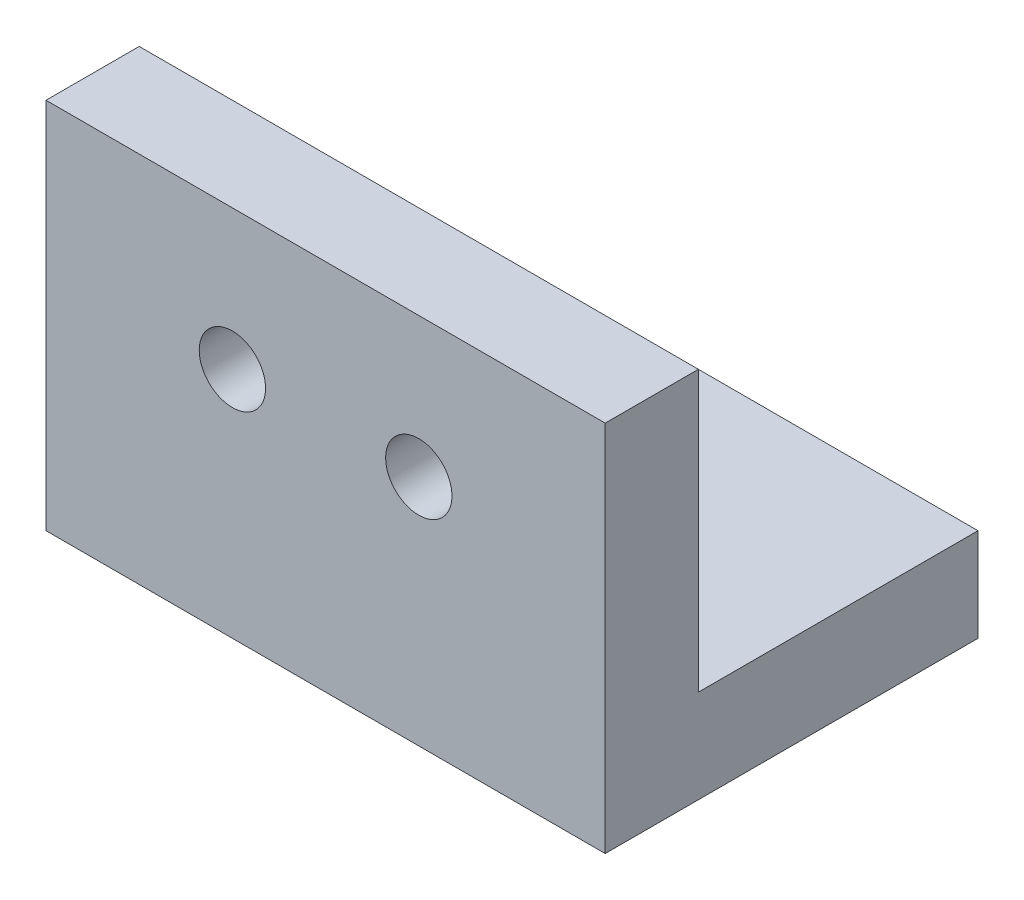
from build123d import *

# Parameters (mm, degrees)
BOSS_EXTRUDE1_DEPTH             = 19.05
F_43_0_089_DIAMETER_HOLE1_D     = 2.2606
F_43_0_089_DIAMETER_HOLE1_DEPTH = 25.4
F_43_0_089_DIAMETER_HOLE1_TIP   = 0.679152758
F_43_0_089_DIAMETER_HOLE2_D     = 2.2606
F_43_0_089_DIAMETER_HOLE2_DEPTH = 25.4
F_43_0_089_DIAMETER_HOLE2_TIP   = 0.679152758


with BuildPart() as part:
    # Sketch1 → Boss-Extrude1 (new body)
    with BuildSketch(Plane(origin=(0, 0, 0), x_dir=(0, 0, -1), z_dir=(1, 0, 0))):
        Polygon((0, 0), (0, 12.7), (3.175, 12.7), (3.175, 3.175), (12.7, 3.175), (12.7, 0), align=None)
    extrude(amount=BOSS_EXTRUDE1_DEPTH)

    # #43 (0.089) Diameter Hole1
    with Locations(Plane(origin=(0, 0, -3.175), x_dir=(-1, 0, 0), z_dir=(0, 0, -1))):
        with Locations((-6.35, 7.9375), (-12.7, 7.9375)):
            Hole(F_43_0_089_DIAMETER_HOLE1_D / 2, depth=F_43_0_089_DIAMETER_HOLE1_DEPTH)
            with Locations((0, 0, -(F_43_0_089_DIAMETER_HOLE1_DEPTH + F_43_0_089_DIAMETER_HOLE1_TIP / 2))):  # 118° drill point
                Cone(0, F_43_0_089_DIAMETER_HOLE1_D / 2, F_43_0_089_DIAMETER_HOLE1_TIP, mode=Mode.SUBTRACT)

    # #43 (0.089) Diameter Hole2
    with Locations(Plane(origin=(0, 3.175, 0), x_dir=(1, 0, 0), z_dir=(0, 1, 0))):
        with Locations((6.35, 7.9375), (12.7, 7.9375)):
            Hole(F_43_0_089_DIAMETER_HOLE2_D / 2, depth=F_43_0_089_DIAMETER_HOLE2_DEPTH)
            with Locations((0, 0, -(F_43_0_089_DIAMETER_HOLE2_DEPTH + F_43_0_089_DIAMETER_HOLE2_TIP / 2))):  # 118° drill point
                Cone(0, F_43_0_089_DIAMETER_HOLE2_D / 2, F_43_0_089_DIAMETER_HOLE2_TIP, mode=Mode.SUBTRACT)


solid = part.part
